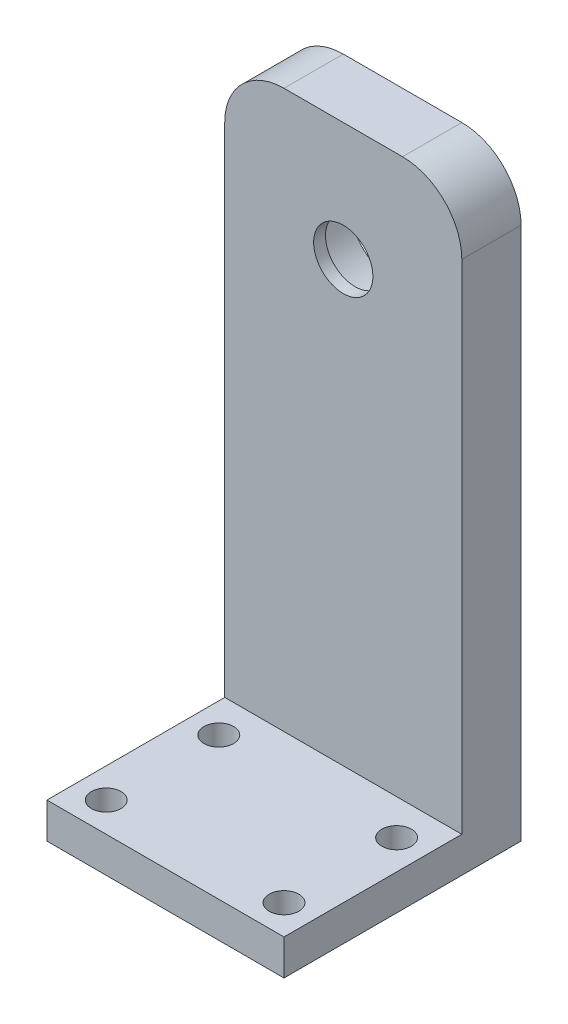
from build123d import *

# Parameters (mm, degrees)
SKETCH_1_W          = 40
SKETCH_1_H          = 30
EXTRUDE_1_DEPTH     = 10
SKETCH_2_W          = 20
SKETCH_2_H          = 5
CUT_EXTRUDE_1_DEPTH = 50
SKETCH_3_W          = 40
SKETCH_3_H          = 8
EXTRUDE_2_DEPTH     = 30
SKETCH_4_W          = 40
SKETCH_4_H          = 2
CUT_EXTRUDE_2_DEPTH = 48.16990566
SKETCH_5_R          = 2.5
CUT_EXTRUDE_3_DEPTH = 15
SKETCH_7_R          = 2.5
CUT_EXTRUDE_4_DEPTH = 15
SKETCH_8_W          = 40
SKETCH_8_H          = 100
EXTRUDE_3_DEPTH     = 10
SKETCH_9_R          = 5
CUT_EXTRUDE_5_DEPTH = 103.29369482
FILLET_1_R          = 10
SKETCH_13_R         = 9.5
CUT_EXTRUDE_8_DEPTH = 99.812954616
SKETCH_14_R         = 9.5
SKETCH_14_R_2       = 5
EXTRUDE_5_DEPTH     = 2


with BuildPart() as part:
    # 草图1 → 凸台-拉伸1 (new body)
    with BuildSketch(Plane.XY):
        Rectangle(SKETCH_1_W, SKETCH_1_H)
    extrude(amount=EXTRUDE_1_DEPTH)

    # 草图2 → 切除-拉伸1 (cut)
    with BuildSketch(Plane.XY.offset(10)):
        with BuildLine():
            ThreePointArc((-20, 12.5), (-19.267766953, 14.267766953), (-17.5, 15))
            Line((-17.5, 15), (-20, 15))
            Line((-20, 15), (-20, 12.5))
        make_face()
        with BuildLine():
            ThreePointArc((5, 5), (3.535533906, 8.535533906), (0, 10))
            Line((0, 10), (0, 0))
            ThreePointArc((0, 0), (3.535533906, 1.464466094), (5, 5))
        make_face()
        with BuildLine():
            Line((0, 0), (0, 10))
            ThreePointArc((0, 10), (-5, 5), (0, 0))
        make_face()
        with BuildLine():
            Line((20, 15), (17.5, 15))
            ThreePointArc((17.5, 15), (19.267766953, 14.267766953), (20, 12.5))
            Line((20, 12.5), (20, 15))
        make_face()
        with Locations((10, -12.5)):
            Rectangle(SKETCH_2_W, SKETCH_2_H)
        with Locations((-10, -12.5)):
            Rectangle(SKETCH_2_W, SKETCH_2_H)
    extrude(amount=-CUT_EXTRUDE_1_DEPTH, mode=Mode.SUBTRACT)

    # 草图3 → 凸台-拉伸2 (add)
    with BuildSketch(Plane.XY.offset(10)):
        with Locations((0, -6)):
            Rectangle(SKETCH_3_W, SKETCH_3_H)
    extrude(amount=EXTRUDE_2_DEPTH)

    # 草图4 → 切除-拉伸2 (cut, through all)
    with BuildSketch(Plane.XY.offset(40)):
        with Locations((0, -9)):
            Rectangle(SKETCH_4_W, SKETCH_4_H)
    extrude(amount=-CUT_EXTRUDE_2_DEPTH, mode=Mode.SUBTRACT)

    # 草图5 → 切除-拉伸3 (cut)
    with BuildSketch(Plane(origin=(0, -2, 0), x_dir=(1, 0, 0), z_dir=(0, 1, 0))):
        with Locations(Location((-15, -35, 0), (0, 0, 270))):
            Circle(SKETCH_5_R)
        with Locations(Location((15, -35, 0), (0, 0, 270))):
            Circle(SKETCH_5_R)
    extrude(amount=-CUT_EXTRUDE_3_DEPTH, mode=Mode.SUBTRACT)

    # 草图7 → 切除-拉伸4 (cut)
    with BuildSketch(Plane(origin=(0, -2, 0), x_dir=(1, 0, 0), z_dir=(0, 1, 0))):
        with Locations(Location((-15, -16, 0), (0, 0, 270))):
            Circle(SKETCH_7_R)
        with Locations(Location((15, -16, 0), (0, 0, 270))):
            Circle(SKETCH_7_R)
    extrude(amount=-CUT_EXTRUDE_4_DEPTH, mode=Mode.SUBTRACT)

    # 草图8 → 凸台-拉伸3 (add)
    with BuildSketch(Plane(origin=(0, 0, 0), x_dir=(-1, 0, 0), z_dir=(0, 0, -1))):
        with Locations((0, 42)):
            Rectangle(SKETCH_8_W, SKETCH_8_H)
    extrude(amount=-EXTRUDE_3_DEPTH)

    # 草图9 → 切除-拉伸5 (cut, through all)
    with BuildSketch(Plane(origin=(0, 0, 0), x_dir=(-1, 0, 0), z_dir=(0, 0, -1))):
        with Locations((0, 72)):
            Circle(SKETCH_9_R)
    extrude(amount=-CUT_EXTRUDE_5_DEPTH, mode=Mode.SUBTRACT)

    # 圆角1
    fillet_1_edges = [part.edges().sort_by_distance(p)[0] for p in [
        (-20, 92, 5),
        (20, 92, 5),
    ]]
    fillet(fillet_1_edges, radius=FILLET_1_R)

    # 草图13 → 切除-拉伸8 (cut, through all)
    with BuildSketch(Plane.XY.offset(10)):
        with Locations((0, 72)):
            Circle(SKETCH_13_R)
    extrude(amount=-CUT_EXTRUDE_8_DEPTH, mode=Mode.SUBTRACT)

    # 草图14 → 凸台-拉伸5 (add)
    with BuildSketch(Plane.XY.offset(10)):
        with Locations((0, 72)):
            Circle(SKETCH_14_R)
        with Locations((0, 72)):
            Circle(SKETCH_14_R_2, mode=Mode.SUBTRACT)
    extrude(amount=-EXTRUDE_5_DEPTH)


solid = part.part
